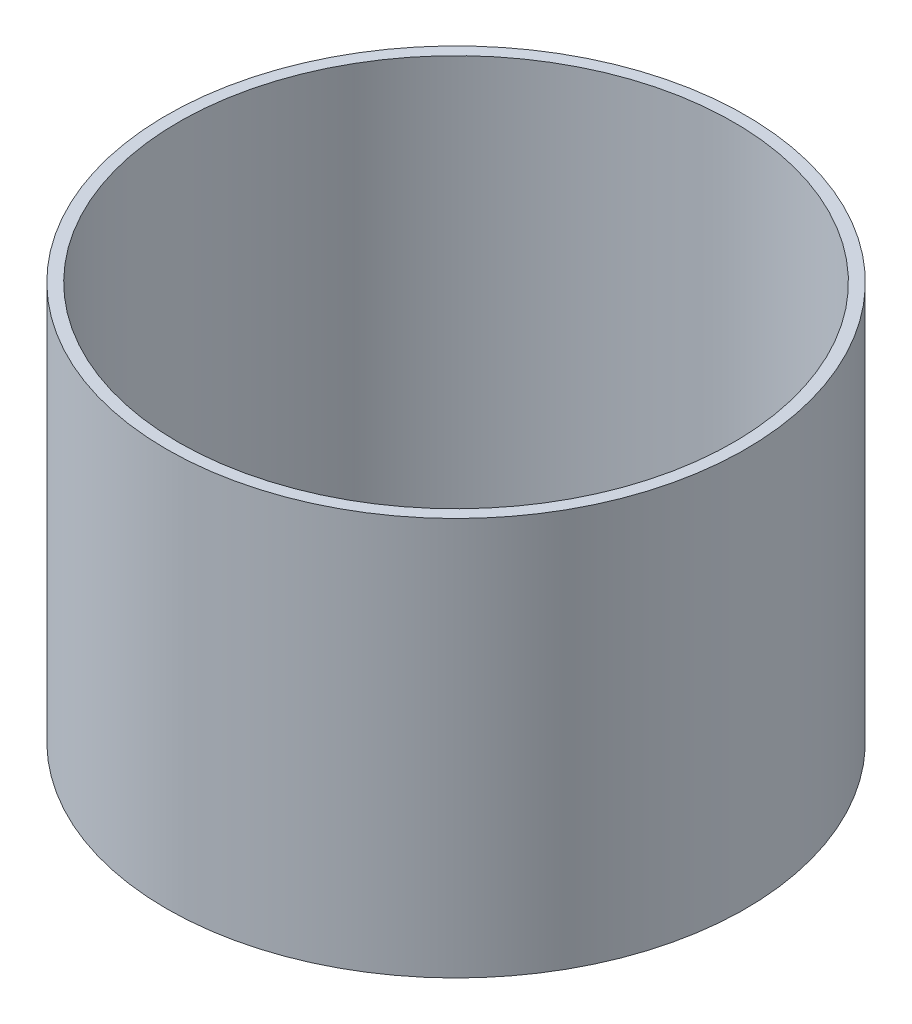
from build123d import *

# Parameters (mm, degrees)
CROQUIS2_R              = 80
CROQUIS2_R_2            = 76.7
SALIENTE_EXTRUIR1_DEPTH = 110


with BuildPart() as part:
    # Croquis2 → Saliente-Extruir1 (new body)
    with BuildSketch(Plane(origin=(0, 0, 0), x_dir=(1, 0, 0), z_dir=(0, 1, 0))):
        with Locations(Location((0, 0, 0), (0, 0, 270))):
            Circle(CROQUIS2_R)
        with Locations(Location((0, 0, 0), (0, 0, 270))):
            Circle(CROQUIS2_R_2, mode=Mode.SUBTRACT)
    extrude(amount=-SALIENTE_EXTRUIR1_DEPTH)


solid = part.part
